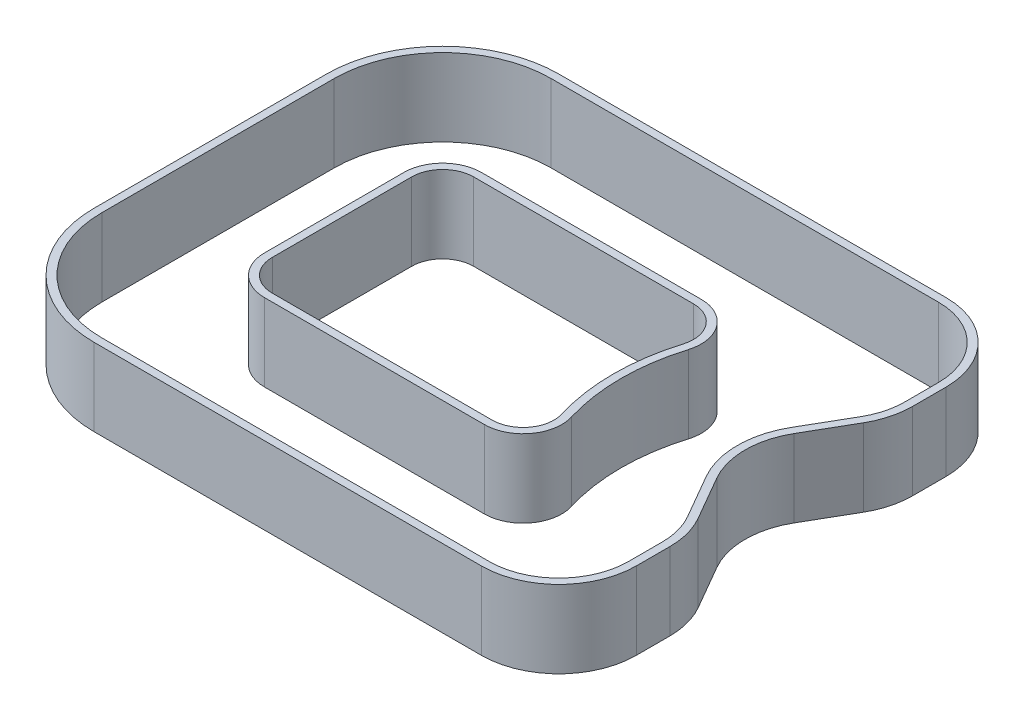
from build123d import *

# Parameters (mm, degrees)
EXTRUDE_2_DEPTH   = 20
EXTRUDE_2_2_DEPTH = 20


with BuildPart() as part:
    # 草图2 → 凸台-拉伸2 (new body)
    with BuildSketch(Plane(origin=(0, 0, 0), x_dir=(1, 0, 0), z_dir=(0, 1, 0))):
        with BuildLine():
            ThreePointArc((30, 0), (8.786796564, 8.786796564), (0, 30))
            Line((0, 30), (0, 90))
            ThreePointArc((0, 90), (8.786796564, 111.213203436), (30, 120))
            Line((30, 120), (130, 120))
            ThreePointArc((130, 120), (144.142135624, 114.142135624), (150, 100))
            Line((150, 100), (150, 91.339745962))
            ThreePointArc((150, 91.339745962), (149.318516526, 86.16336506), (147.320508076, 81.339745962))
            Line((147.320508076, 81.339745962), (140.773502692, 70))
            ThreePointArc((140.773502692, 70), (138.094010768, 60), (140.773502692, 50))
            Line((140.773502692, 50), (147.320508076, 38.660254038))
            ThreePointArc((147.320508076, 38.660254038), (149.318516526, 33.83663494), (150, 28.660254038))
            Line((150, 28.660254038), (150, 20))
            ThreePointArc((150, 20), (144.142135624, 5.857864376), (130, 0))
            Line((130, 0), (30, 0))
        make_face()
        with BuildLine():
            Line((2, 30), (2, 90))
            ThreePointArc((2, 90), (10.201010127, 109.798989873), (30, 118))
            Line((30, 118), (130, 118))
            ThreePointArc((130, 118), (142.727922061, 112.727922061), (148, 100))
            Line((148, 100), (148, 91.339745962))
            ThreePointArc((148, 91.339745962), (147.386664873, 86.68100315), (145.588457268, 82.339745962))
            Line((145.588457268, 82.339745962), (139.041451884, 71))
            ThreePointArc((139.041451884, 71), (136.094010768, 60), (139.041451884, 49))
            Line((139.041451884, 49), (145.588457268, 37.660254038))
            ThreePointArc((145.588457268, 37.660254038), (147.386664873, 33.31899685), (148, 28.660254038))
            Line((148, 28.660254038), (148, 20))
            ThreePointArc((148, 20), (142.727922061, 7.272077939), (130, 2))
            Line((130, 2), (30, 2))
            ThreePointArc((30, 2), (10.201010127, 10.201010127), (2, 30))
        make_face(mode=Mode.SUBTRACT)
    extrude(amount=EXTRUDE_2_DEPTH)


with BuildPart() as body_2:
    # 草图2 → Extrude 2 2 (new body)
    with BuildSketch(Plane(origin=(0, 0, 0), x_dir=(1, 0, 0), z_dir=(0, 1, 0))):
        with BuildLine():
            ThreePointArc((32, 78), (34.928932188, 85.071067812), (42, 88))
            Line((42, 88), (98.764422871, 88))
            ThreePointArc((98.764422871, 88), (106.79661616, 83.956833972), (108.333711241, 75.096774194))
            ThreePointArc((108.333711241, 75.096774194), (106.094010768, 60), (108.333711241, 44.903225806))
            ThreePointArc((108.333711241, 44.903225806), (106.79661616, 36.043166028), (98.764422871, 32))
            Line((98.764422871, 32), (42, 32))
            ThreePointArc((42, 32), (34.928932188, 34.928932188), (32, 42))
            Line((32, 42), (32, 78))
        make_face()
        with BuildLine():
            Line((34, 42), (34, 78))
            ThreePointArc((34, 78), (36.343145751, 83.656854249), (42, 86))
            Line((42, 86), (98.764422871, 86))
            ThreePointArc((98.764422871, 86), (105.190177502, 82.765467177), (106.419853567, 75.677419355))
            ThreePointArc((106.419853567, 75.677419355), (104.094010768, 60), (106.419853567, 44.322580645))
            ThreePointArc((106.419853567, 44.322580645), (105.190177502, 37.234532823), (98.764422871, 34))
            Line((98.764422871, 34), (42, 34))
            ThreePointArc((42, 34), (36.343145751, 36.343145751), (34, 42))
        make_face(mode=Mode.SUBTRACT)
    extrude(amount=EXTRUDE_2_2_DEPTH)


solid = Compound([part.part, body_2.part])
